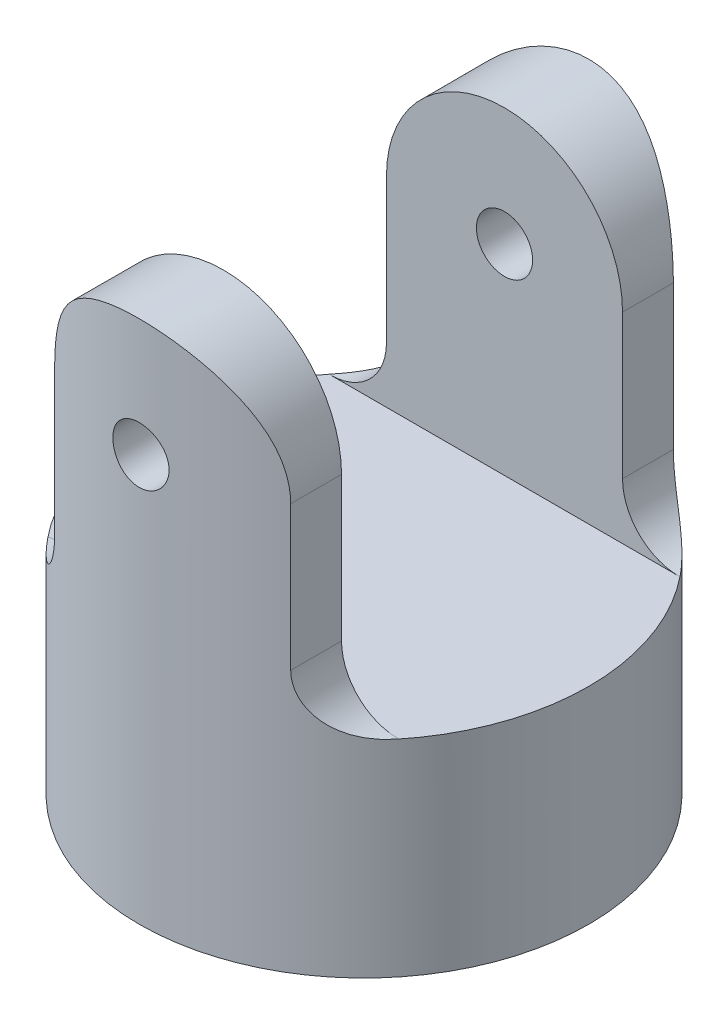
from build123d import *

# Parameters (mm, degrees)
SKETCH1_R               = 6
BOSS_EXTRUDE1_DEPTH     = 14
CUT_EXTRUDE1_DEPTH      = 17.370705544
CUT_EXTRUDE1_DEPTH_BACK = 17.370705544
SKETCH2_W               = 7.5
SKETCH2_H               = 8.5
CUT_EXTRUDE2_DEPTH      = 17.370705544
CUT_EXTRUDE2_DEPTH_BACK = 17.370705544
SKETCH3_R               = 0.75


with BuildPart() as part:
    # Sketch1 → Boss-Extrude1 (new body)
    with BuildSketch(Plane(origin=(0, 0, 0), x_dir=(1, 0, 0), z_dir=(0, 1, 0))):
        with Locations(Location((0, 0, 0), (0, 0, 270))):
            Circle(SKETCH1_R)
    extrude(amount=BOSS_EXTRUDE1_DEPTH)

    # Sketch2 → Cut-Extrude1 (cut, two sides: drawn at the far end of the back side and taken through both)
    with BuildSketch(Plane(origin=(0, 0, 0), x_dir=(0, 0, -1), z_dir=(1, 0, 0)).offset(-CUT_EXTRUDE1_DEPTH_BACK)):
        with Locations((0, 9.75)):
            Rectangle(SKETCH2_W, SKETCH2_H)
    extrude(amount=CUT_EXTRUDE1_DEPTH + CUT_EXTRUDE1_DEPTH_BACK, mode=Mode.SUBTRACT)

    # Sketch3 → Cut-Extrude2 (cut, two sides: drawn at the far end of the back side and taken through both)
    with BuildSketch(Plane.XY.offset(-CUT_EXTRUDE2_DEPTH_BACK)):
        with BuildLine():
            Line((-3.15, 7), (-3.15, 10.85))
            ThreePointArc((-3.15, 10.85), (-2.227386361, 13.077386361), (0, 14))
            Line((0, 14), (-4.683748499, 14))
            Line((-4.683748499, 14), (-4.683748499, 5.5))
            Line((-4.683748499, 5.5), (-4.65, 5.5))
            ThreePointArc((-4.65, 5.5), (-3.589339828, 5.939339828), (-3.15, 7))
        make_face()
        with BuildLine():
            Line((4.683748499, 14), (0, 14))
            ThreePointArc((0, 14), (2.227386361, 13.077386361), (3.15, 10.85))
            Line((3.15, 10.85), (3.15, 7))
            ThreePointArc((3.15, 7), (3.589339828, 5.939339828), (4.65, 5.5))
            Line((4.65, 5.5), (4.683748499, 5.5))
            Line((4.683748499, 5.5), (4.683748499, 14))
        make_face()
        with Locations((0, 10.85)):
            Circle(SKETCH3_R)
    extrude(amount=CUT_EXTRUDE2_DEPTH + CUT_EXTRUDE2_DEPTH_BACK, mode=Mode.SUBTRACT)


solid = part.part
